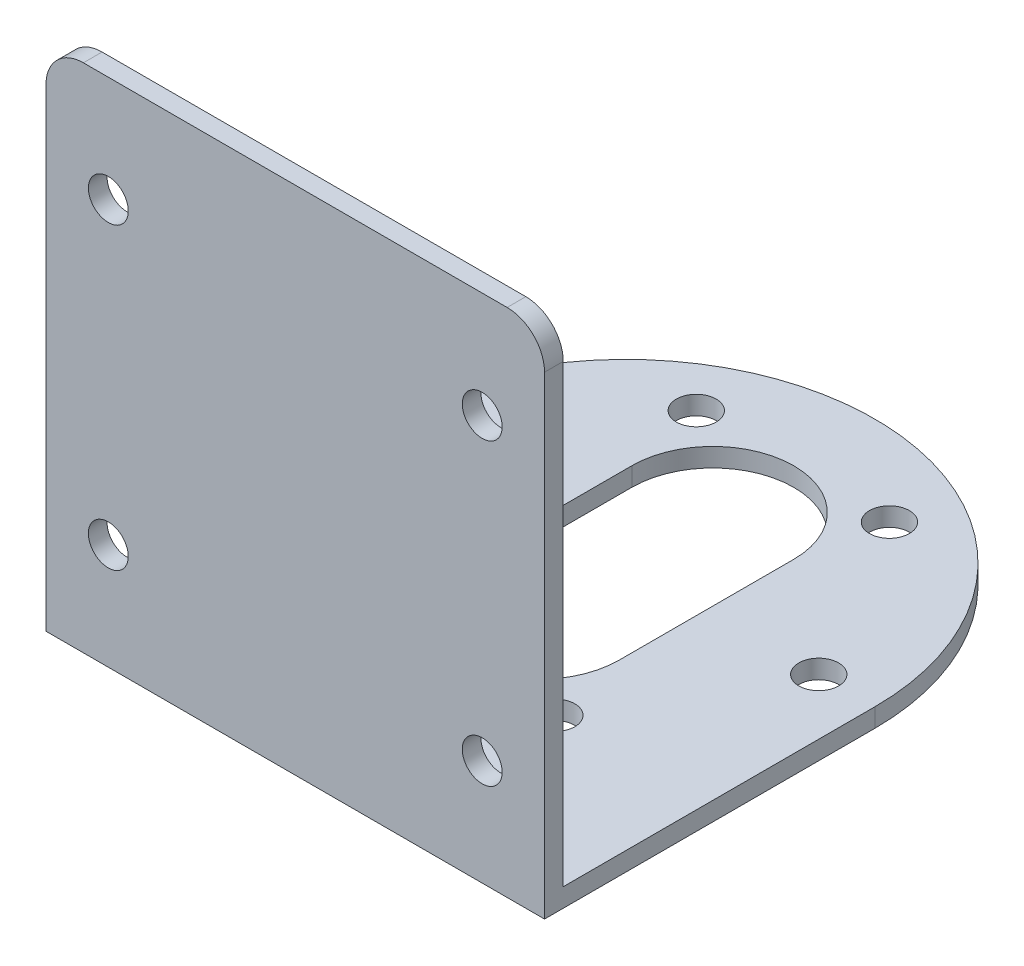
from build123d import *

# Parameters (mm, degrees)
SKETCH_1_R          = 1.6
EXTRUDE_1_DEPTH     = 1.5
SKETCH_3_W          = 40
SKETCH_3_H          = 1.5
EXTRUDE_2_DEPTH     = 39.5
CUT_EXTRUDE_1_REACH = 67.14
SKETCH_4_R          = 1.6
FILLET_1_R          = 3


with BuildPart() as part:
    # 草图1 → 凸台-拉伸1 (new body)
    with BuildSketch(Plane(origin=(0, 0, 0), x_dir=(1, 0, 0), z_dir=(0, 1, 0))):
        with BuildLine():
            Line((-20, -13.25), (20, -13.25))
            Line((20, -13.25), (20, 13.25))
            ThreePointArc((20, 13.25), (0, 33.25), (-20, 13.25))
            Line((-20, 13.25), (-20, -13.25))
        make_face()
        with Locations(Location((15.5, 13.25, 0), (0, 0, 270))):
            Circle(SKETCH_1_R, mode=Mode.SUBTRACT)
        with Locations(Location((7.75, -0.173393759, 0), (0, 0, 270))):
            Circle(SKETCH_1_R, mode=Mode.SUBTRACT)
        with Locations(Location((-7.75, -0.173393759, 0), (0, 0, 270))):
            Circle(SKETCH_1_R, mode=Mode.SUBTRACT)
        with Locations(Location((-15.5, 13.25, 0), (0, 0, 270))):
            Circle(SKETCH_1_R, mode=Mode.SUBTRACT)
        with Locations(Location((-7.75, 26.673393759, 0), (0, 0, 270))):
            Circle(SKETCH_1_R, mode=Mode.SUBTRACT)
        with Locations(Location((7.75, 26.673393759, 0), (0, 0, 270))):
            Circle(SKETCH_1_R, mode=Mode.SUBTRACT)
        with BuildLine():
            Line((-6.5, 20.25), (-6.5, 6.25))
            ThreePointArc((-6.5, 6.25), (0, -0.25), (6.5, 6.25))
            Line((6.5, 6.25), (6.5, 20.25))
            ThreePointArc((6.5, 20.25), (0, 26.75), (-6.5, 20.25))
        make_face(mode=Mode.SUBTRACT)
    extrude(amount=EXTRUDE_1_DEPTH)

    # 草图3 → 凸台-拉伸2 (add)
    with BuildSketch(Plane(origin=(0, 1.5, 0), x_dir=(1, 0, 0), z_dir=(0, 1, 0))):
        with Locations((0, -12.5)):
            Rectangle(SKETCH_3_W, SKETCH_3_H)
    extrude(amount=EXTRUDE_2_DEPTH)

    # 草图4 → 切除-拉伸1 (cut, up to next)
    with BuildSketch(Plane.XY.offset(13.25), mode=Mode.PRIVATE) as cut_extrude_1_sk1:
        with Locations((-15, 32.5)):
            Circle(SKETCH_4_R)
    cut_extrude_1_tool1 = extrude(cut_extrude_1_sk1.sketch, amount=-CUT_EXTRUDE_1_REACH, mode=Mode.PRIVATE) & part.part
    # 草图4 → 切除-拉伸1 (cut, up to next)
    with BuildSketch(Plane.XY.offset(13.25), mode=Mode.PRIVATE) as cut_extrude_1_sk2:
        with Locations((15, 32.5)):
            Circle(SKETCH_4_R)
    cut_extrude_1_tool2 = extrude(cut_extrude_1_sk2.sketch, amount=-CUT_EXTRUDE_1_REACH, mode=Mode.PRIVATE) & part.part
    # 草图4 → 切除-拉伸1 (cut, up to next)
    with BuildSketch(Plane.XY.offset(13.25), mode=Mode.PRIVATE) as cut_extrude_1_sk3:
        with Locations((15, 8.5)):
            Circle(SKETCH_4_R)
    cut_extrude_1_tool3 = extrude(cut_extrude_1_sk3.sketch, amount=-CUT_EXTRUDE_1_REACH, mode=Mode.PRIVATE) & part.part
    # 草图4 → 切除-拉伸1 (cut, up to next)
    with BuildSketch(Plane.XY.offset(13.25), mode=Mode.PRIVATE) as cut_extrude_1_sk4:
        with Locations((-15, 8.5)):
            Circle(SKETCH_4_R)
    cut_extrude_1_tool4 = extrude(cut_extrude_1_sk4.sketch, amount=-CUT_EXTRUDE_1_REACH, mode=Mode.PRIVATE) & part.part
    add(cut_extrude_1_tool1.solids().sort_by_distance((-15, 32.5, 13.25))[0], mode=Mode.SUBTRACT)
    add(cut_extrude_1_tool2.solids().sort_by_distance((15, 32.5, 13.25))[0], mode=Mode.SUBTRACT)
    add(cut_extrude_1_tool3.solids().sort_by_distance((15, 8.5, 13.25))[0], mode=Mode.SUBTRACT)
    add(cut_extrude_1_tool4.solids().sort_by_distance((-15, 8.5, 13.25))[0], mode=Mode.SUBTRACT)

    # 圆角1
    fillet_1_edges = [part.edges().sort_by_distance(p)[0] for p in [
        (-20, 41, 12.5),
        (20, 41, 12.5),
    ]]
    fillet(fillet_1_edges, radius=FILLET_1_R)


solid = part.part
